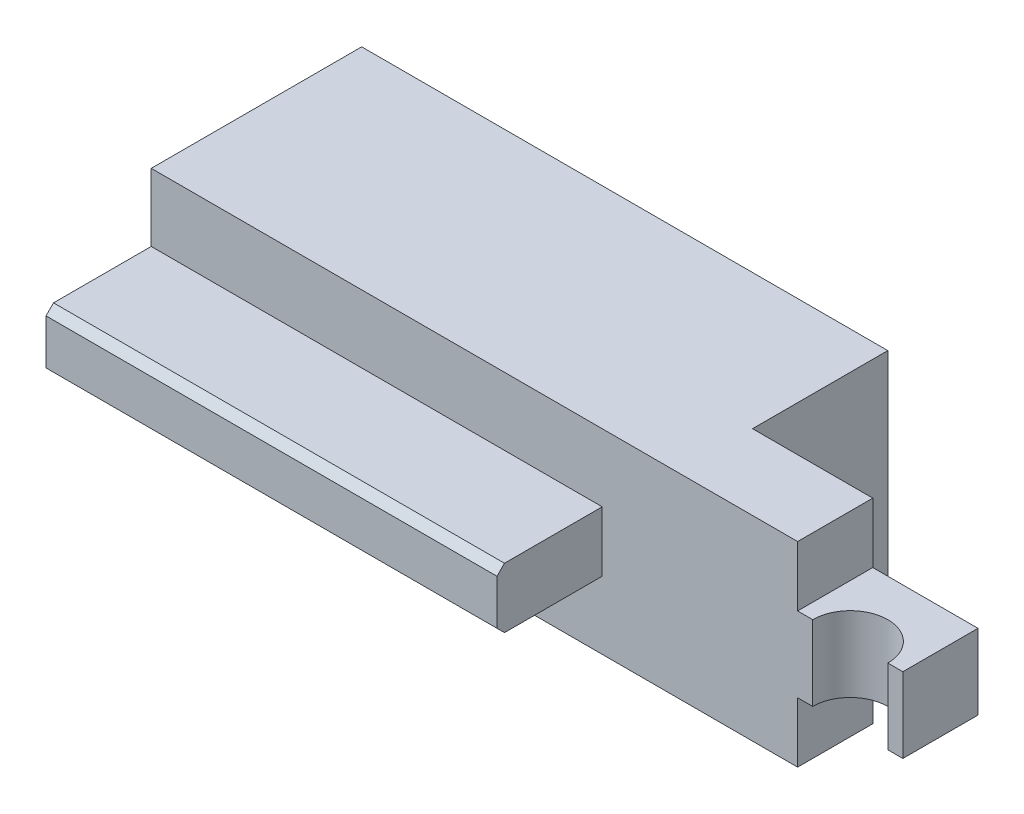
from build123d import *

# Parameters (mm, degrees)
SKETCH_1_W                      = 25
SKETCH_1_H                      = 17
EXTRUDE_1_DEPTH                 = 50
SKETCH_2_W                      = 11
SKETCH_2_H                      = 6
CUT_EXTRUDE_1_DEPTH             = 50
SKETCH_3_W                      = 20
SKETCH_3_H                      = 11
CUT_EXTRUDE_2_DEPTH             = 50
SKETCH_4_W                      = 7
SKETCH_4_H                      = 6
CUT_EXTRUDE_3_DEPTH             = 50
SKETCH_5_W                      = 7
SKETCH_5_H                      = 9
CUT_EXTRUDE_4_DEPTH             = 50
SKETCH_6_R                      = 2.5
CUT_EXTRUDE_5_DEPTH             = 50
SKETCH_7_W                      = 14
SKETCH_7_H                      = 2
CUT_EXTRUDE_8_DEPTH             = 50
SKETCH_10_W                     = 4
SKETCH_10_H                     = 5
CUT_EXTRUDE_9_DEPTH             = 50
SKETCH_11_W                     = 8
SKETCH_11_H                     = 7
CUT_EXTRUDE_10_DEPTH            = 30
CUT_EXTRUDE_11_DEPTH            = 50
CUT_EXTRUDE_12_DEPTH            = 50
SKETCH_14_R                     = 1.55
CUT_EXTRUDE_13_DEPTH            = 5
SKIZZE1_W                       = 9
SKIZZE1_H                       = 13
SCHNITT_LINEAR_AUSTRAGEN1_DEPTH = 8


with BuildPart() as part:
    # 草图1 → 凸台-拉伸1 (new body)
    with BuildSketch(Plane(origin=(0, 0, 0), x_dir=(0, 0, -1), z_dir=(1, 0, 0))):
        with Locations((12.5, 8.5)):
            Rectangle(SKETCH_1_W, SKETCH_1_H)
    extrude(amount=EXTRUDE_1_DEPTH)

    # 草图2 → 切除-拉伸1 (cut)
    with BuildSketch(Plane.ZY):
        with Locations((-5.5, 14)):
            Rectangle(SKETCH_2_W, SKETCH_2_H)
        with Locations((-5.5, 3)):
            Rectangle(SKETCH_2_W, SKETCH_2_H)
    extrude(amount=-CUT_EXTRUDE_1_DEPTH, mode=Mode.SUBTRACT)

    # 草图3 → 切除-拉伸2 (cut)
    with BuildSketch(Plane(origin=(0, 11, 0), x_dir=(1, 0, 0), z_dir=(0, 1, 0))):
        with Locations((40, 5.5)):
            Rectangle(SKETCH_3_W, SKETCH_3_H)
    extrude(amount=-CUT_EXTRUDE_2_DEPTH, mode=Mode.SUBTRACT)

    # 草图4 → 切除-拉伸3 (cut)
    with BuildSketch(Plane(origin=(0, 0, -25), x_dir=(-1, 0, 0), z_dir=(0, 0, -1))):
        with Locations((-46.5, 14)):
            Rectangle(SKETCH_4_W, SKETCH_4_H)
        with Locations((-46.5, 3)):
            Rectangle(SKETCH_4_W, SKETCH_4_H)
    extrude(amount=-CUT_EXTRUDE_3_DEPTH, mode=Mode.SUBTRACT)

    # 草图5 → 切除-拉伸4 (cut)
    with BuildSketch(Plane(origin=(0, 11, 0), x_dir=(1, 0, 0), z_dir=(0, 1, 0))):
        with Locations((46.5, 20.5)):
            Rectangle(SKETCH_5_W, SKETCH_5_H)
    extrude(amount=-CUT_EXTRUDE_4_DEPTH, mode=Mode.SUBTRACT)

    # 草图6 → 切除-拉伸5 (cut)
    with BuildSketch(Plane(origin=(0, 11, 0), x_dir=(1, 0, 0), z_dir=(0, 1, 0))):
        with Locations((46.5, 11)):
            Circle(SKETCH_6_R)
    extrude(amount=-CUT_EXTRUDE_5_DEPTH, mode=Mode.SUBTRACT)

    # 草图7 → 切除-拉伸8 (cut)
    with BuildSketch(Plane.ZY):
        with Locations((-18, 16)):
            Rectangle(SKETCH_7_W, SKETCH_7_H)
        with Locations((-18, 1)):
            Rectangle(SKETCH_7_W, SKETCH_7_H)
    extrude(amount=-CUT_EXTRUDE_8_DEPTH, mode=Mode.SUBTRACT)

    # 草图10 → 切除-拉伸9 (cut)
    with BuildSketch(Plane.ZY):
        with Locations((-2, 8.5)):
            Rectangle(SKETCH_10_W, SKETCH_10_H)
    extrude(amount=-CUT_EXTRUDE_9_DEPTH, mode=Mode.SUBTRACT)

    # 草图11 → 切除-拉伸10 (cut)
    with BuildSketch(Plane.ZY):
        with Locations((-18, 8.5)):
            Rectangle(SKETCH_11_W, SKETCH_11_H)
    extrude(amount=-CUT_EXTRUDE_10_DEPTH, mode=Mode.SUBTRACT)

    # 草图12 → 切除-拉伸11 (cut)
    with BuildSketch(Plane.ZY):
        Polygon((-4, 11), (-4, 10), (-5, 11), align=None)
        Polygon((-4, 6), (-5, 6), (-4, 7), align=None)
    extrude(amount=-CUT_EXTRUDE_11_DEPTH, mode=Mode.SUBTRACT)

    # 草图13 → 切除-拉伸12 (cut)
    with BuildSketch(Plane.ZY):
        Polygon((-11, 11), (-11, 10.5), (-4.5, 10.5), (-5, 11), align=None)
        Polygon((-4.5, 6.5), (-5, 6), (-11, 6), (-11, 6.5), align=None)
    extrude(amount=-CUT_EXTRUDE_12_DEPTH, mode=Mode.SUBTRACT)

    # 草图14 → 切除-拉伸13 (cut)
    with BuildSketch(Plane(origin=(0, 0, -25), x_dir=(-1, 0, 0), z_dir=(0, 0, -1))):
        with Locations((-3, 8.5)):
            Circle(SKETCH_14_R)
        with Locations((-11, 8.5)):
            Circle(SKETCH_14_R)
    extrude(amount=-CUT_EXTRUDE_13_DEPTH, mode=Mode.SUBTRACT)

    # Skizze1 → Schnitt-Linear austragen1 (cut)
    with BuildSketch(Plane(origin=(43, 0, 0), x_dir=(0, 0, -1), z_dir=(1, 0, 0))):
        with Locations((20.5, 8.5)):
            Rectangle(SKIZZE1_W, SKIZZE1_H)
    extrude(amount=-SCHNITT_LINEAR_AUSTRAGEN1_DEPTH, mode=Mode.SUBTRACT)


solid = part.part
